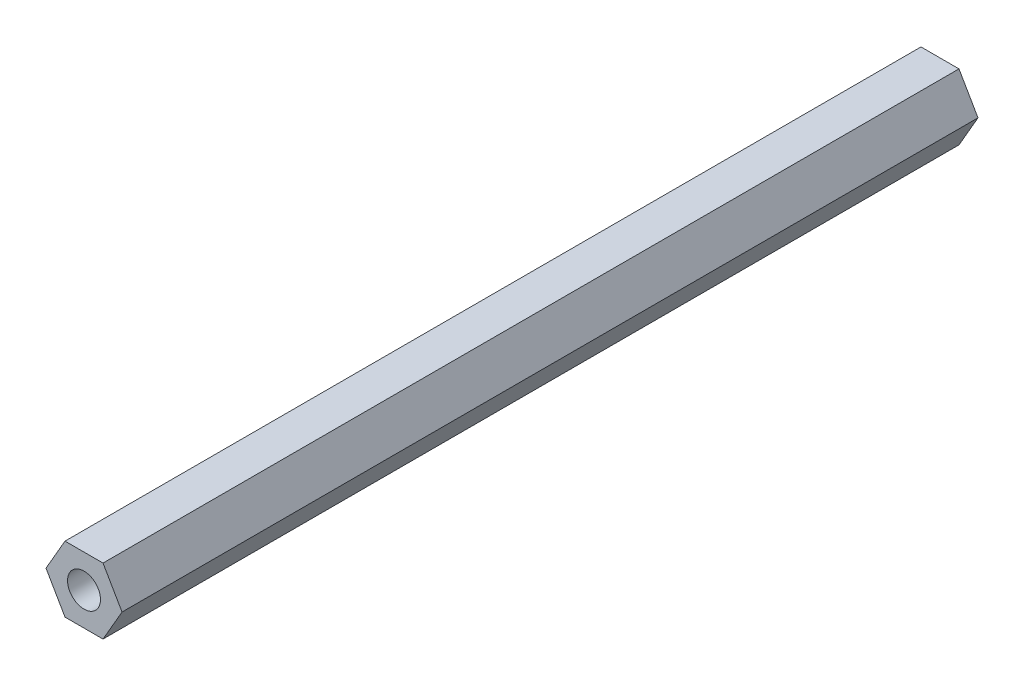
from build123d import *

# Parameters (mm, degrees)
SKETCH_1_R             = 1.5
EXTRUDE_1_DEPTH        = 65
HOLE_WIZARD_M3_1_D     = 2.5
HOLE_WIZARD_M3_1_DEPTH = 7.5
HOLE_WIZARD_M3_1_TIP   = 0.751075774


with BuildPart() as part:
    # 草图1 → 凸台-拉伸1 (new body)
    # profile 1 of 2: a face of its own
    with BuildSketch(Plane.XY):
        Polygon((-1.443375673, -2.5), (1.443375673, -2.5), (2.886751346, 0), (1.443375673, 2.5), (-1.443375673, 2.5), (-2.886751346, 0), align=None)
        Circle(SKETCH_1_R, mode=Mode.SUBTRACT)
    # profile 2 of 2: a face of its own
    with BuildSketch(Plane.XY):
        Circle(SKETCH_1_R)
    extrude(amount=EXTRUDE_1_DEPTH)

    # M3 螺纹孔1
    with Locations(Plane.XY.offset(65)):
        with Locations((0, 0)):
            Hole(HOLE_WIZARD_M3_1_D / 2, depth=HOLE_WIZARD_M3_1_DEPTH)
            with Locations((0, 0, -(HOLE_WIZARD_M3_1_DEPTH + HOLE_WIZARD_M3_1_TIP / 2))):  # 118° drill point
                Cone(0, HOLE_WIZARD_M3_1_D / 2, HOLE_WIZARD_M3_1_TIP, mode=Mode.SUBTRACT)


solid = part.part
